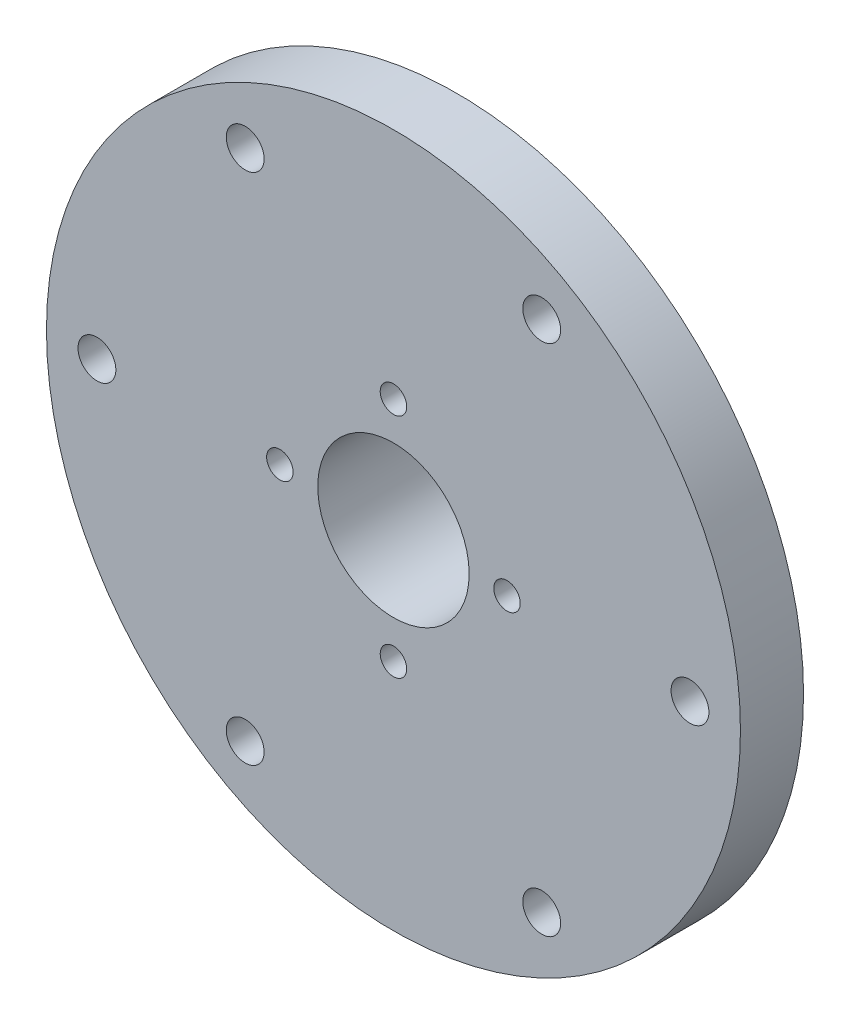
from build123d import *

# Parameters (mm, degrees)
SKETCH_1_R          = 55
SKETCH_1_R_2        = 12
SKETCH_1_R_3        = 3
EXTRUDE_1_DEPTH     = 20
SKETCH_2_OUTSIDE_W  = 143.368
SKETCH_2_OUTSIDE_H  = 143.368
SKETCH_2_OUTSIDE_R  = 25
CUT_EXTRUDE_1_DEPTH = 10
SKETCH_4_R          = 5
CUT_EXTRUDE_2_DEPTH = 15
HOLE_WIZARD_M5_1_D  = 4.2


with BuildPart() as part:
    # 草图1 → 凸台-拉伸1 (new body)
    with BuildSketch(Plane.XY):
        Circle(SKETCH_1_R)
        Circle(SKETCH_1_R_2, mode=Mode.SUBTRACT)
        with Locations((47, 0)):
            Circle(SKETCH_1_R_3, mode=Mode.SUBTRACT)
        with Locations((23.5, -40.703193978)):
            Circle(SKETCH_1_R_3, mode=Mode.SUBTRACT)
        with Locations((-23.5, -40.703193978)):
            Circle(SKETCH_1_R_3, mode=Mode.SUBTRACT)
        with Locations((-47, 0)):
            Circle(SKETCH_1_R_3, mode=Mode.SUBTRACT)
        with Locations((-23.5, 40.703193978)):
            Circle(SKETCH_1_R_3, mode=Mode.SUBTRACT)
        with Locations((23.5, 40.703193978)):
            Circle(SKETCH_1_R_3, mode=Mode.SUBTRACT)
    extrude(amount=EXTRUDE_1_DEPTH)

    # 草图2 outside → 切除-拉伸1 (cut)
    with BuildSketch(Plane.XY):
        Rectangle(SKETCH_2_OUTSIDE_W, SKETCH_2_OUTSIDE_H)
        Circle(SKETCH_2_OUTSIDE_R, mode=Mode.SUBTRACT)
    extrude(amount=CUT_EXTRUDE_1_DEPTH, mode=Mode.SUBTRACT)

    # 草图4 → 切除-拉伸2 (cut)
    with BuildSketch(Plane.XY):
        with Locations((-47, 0)):
            Circle(SKETCH_4_R)
        with Locations((-23.5, 40.703193978)):
            Circle(SKETCH_4_R)
        with Locations((23.5, 40.703193978)):
            Circle(SKETCH_4_R)
        with Locations((47, 0)):
            Circle(SKETCH_4_R)
        with Locations((23.5, -40.703193978)):
            Circle(SKETCH_4_R)
        with Locations((-23.5, -40.703193978)):
            Circle(SKETCH_4_R)
    extrude(amount=CUT_EXTRUDE_2_DEPTH, mode=Mode.SUBTRACT)

    # M5 螺纹孔的螺纹孔钻头1 (through all)
    with Locations(Plane(origin=(0, 0, 0), x_dir=(-1, 0, 0), z_dir=(0, 0, -1))):
        with Locations((0, 18), (18, 0), (0, -18), (-18, 0)):
            Hole(HOLE_WIZARD_M5_1_D / 2)


solid = part.part
